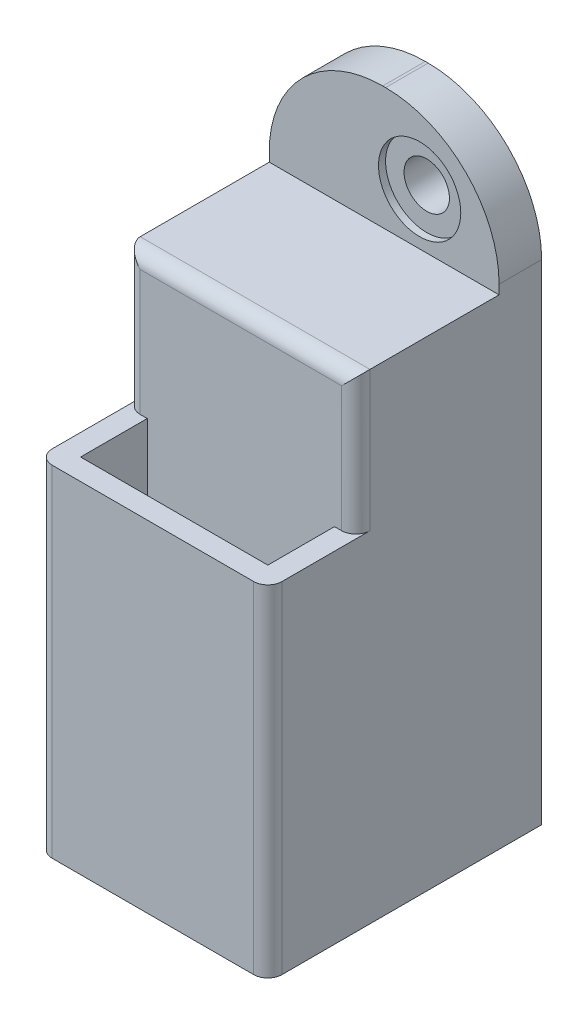
from build123d import *

# Parameters (mm, degrees)
CROQUIS2_W               = 16.2
CROQUIS2_H               = 9.2
CROQUIS2_W_2             = 13.2
CROQUIS2_H_2             = 6.2
SALIENTE_EXTRUIR1_DEPTH  = 6.5
CROQUIS3_W               = 16.2
CROQUIS3_H               = 12
SALIENTE_EXTRUIR2_DEPTH  = 2
SALIENTE_EXTRUIR3_DEPTH  = 8.1
CROQUIS5_W               = 16.2
CROQUIS5_H               = 3
SALIENTE_EXTRUIR4_DEPTH  = 13
CROQUIS6_R               = 1.6
CORTAR_EXTRUIR1_DEPTH    = 3
CROQUIS7_W               = 16.2
CROQUIS7_H               = 2
SALIENTE_EXTRUIR5_DEPTH  = 3
CROQUIS8_R               = 2.9
CORTAR_EXTRUIR2_DEPTH    = 0.5
REDONDEO1_R              = 1
REDONDEO6_R              = 8
CROQUIS9_W               = 13.2
CROQUIS9_H               = 6.2
SALIENTE_EXTRUIR6_DEPTH  = 3.5
CROQUIS10_W              = 13.2
CROQUIS10_H              = 1.5
SALIENTE_EXTRUIR7_DEPTH  = 3.5
CROQUIS11_W              = 13.2
CROQUIS11_H              = 6.2
SALIENTE_EXTRUIR8_DEPTH  = 14
CROQUIS12_W              = 13.2
CROQUIS12_H              = 1.5
SALIENTE_EXTRUIR9_DEPTH  = 14
CROQUIS13_W              = 16.2
CROQUIS13_H              = 7.85
SALIENTE_EXTRUIR10_DEPTH = 10.1
CROQUIS14_W              = 12.6
CROQUIS14_H              = 6.5
CORTAR_EXTRUIR3_DEPTH    = 8.1
REDONDEO7_R              = 1


with BuildPart() as part:
    # Croquis2 → Saliente-Extruir1 (new body)
    with BuildSketch(Plane(origin=(0, 0, 0), x_dir=(1, 0, 0), z_dir=(0, 1, 0))):
        with Locations((6.6, -3.1)):
            Rectangle(CROQUIS2_W, CROQUIS2_H)
        with Locations((6.6, -3.1)):
            Rectangle(CROQUIS2_W_2, CROQUIS2_H_2, mode=Mode.SUBTRACT)
    extrude(amount=SALIENTE_EXTRUIR1_DEPTH)

    # Croquis3 → Saliente-Extruir2 (add)
    with BuildSketch(Plane(origin=(0, 0, -1.5), x_dir=(-1, 0, 0), z_dir=(0, 0, -1))):
        with Locations((-6.6, 6)):
            Rectangle(CROQUIS3_W, CROQUIS3_H)
    extrude(amount=SALIENTE_EXTRUIR2_DEPTH)

    # Croquis4 → Saliente-Extruir3 (add)
    with BuildSketch(Plane(origin=(0, 0, -3.5), x_dir=(-1, 0, 0), z_dir=(0, 0, -1))):
        Polygon((1.5, 0), (1.5, 12), (-14.7, 12), (-14.7, 0), (-12.9, 0), (-12.9, 11), (-0.3, 11), (-0.3, 0), align=None)
    extrude(amount=SALIENTE_EXTRUIR3_DEPTH)

    # Croquis5 → Saliente-Extruir4 (add)
    with BuildSketch(Plane(origin=(0, 12, 0), x_dir=(1, 0, 0), z_dir=(0, 1, 0))):
        with Locations((6.6, 10.1)):
            Rectangle(CROQUIS5_W, CROQUIS5_H)
    extrude(amount=SALIENTE_EXTRUIR4_DEPTH)

    # Croquis6 → Cortar-Extruir1 (cut)
    with BuildSketch(Plane.XY.offset(-8.6)):
        with Locations((9.1, 20)):
            Circle(CROQUIS6_R)
    extrude(amount=-CORTAR_EXTRUIR1_DEPTH, mode=Mode.SUBTRACT)

    # Croquis7 → Saliente-Extruir5 (add)
    with BuildSketch(Plane.XY.offset(-1.5)):
        with Locations((6.6, 7.5)):
            Rectangle(CROQUIS7_W, CROQUIS7_H)
    extrude(amount=SALIENTE_EXTRUIR5_DEPTH)

    # Croquis8 → Cortar-Extruir2 (cut)
    with BuildSketch(Plane.XY.offset(-8.6)):
        with Locations((9.1, 20)):
            Circle(CROQUIS8_R)
    extrude(amount=-CORTAR_EXTRUIR2_DEPTH, mode=Mode.SUBTRACT)

    # Redondeo1
    redondeo1_edges = [part.edges().sort_by_distance(p)[0] for p in [
        (14.7, 3.25, 7.7),
        (-1.5, 3.25, 7.7),
    ]]
    fillet(redondeo1_edges, radius=REDONDEO1_R)

    # Redondeo6
    redondeo6_edges = [part.edges().sort_by_distance(p)[0] for p in [
        (14.7, 25, -10.1),
        (-1.5, 25, -10.1),
    ]]
    fillet(redondeo6_edges, radius=REDONDEO6_R)

    # Croquis9 → Saliente-Extruir6 (add)
    with BuildSketch(Plane.XZ):
        with BuildLine():
            Line((13.7, 7.7), (-0.5, 7.7))
            ThreePointArc((-0.5, 7.7), (-1.207106781, 7.407106781), (-1.5, 6.7))
            Line((-1.5, 6.7), (-1.5, -11.6))
            Line((-1.5, -11.6), (0.3, -11.6))
            Line((0.3, -11.6), (0.3, -3.5))
            Line((0.3, -3.5), (12.9, -3.5))
            Line((12.9, -3.5), (12.9, -11.6))
            Line((12.9, -11.6), (14.7, -11.6))
            Line((14.7, -11.6), (14.7, 6.7))
            ThreePointArc((14.7, 6.7), (14.407106781, 7.407106781), (13.7, 7.7))
        make_face()
        with Locations((6.6, 3.1)):
            Rectangle(CROQUIS9_W, CROQUIS9_H, mode=Mode.SUBTRACT)
    extrude(amount=SALIENTE_EXTRUIR6_DEPTH)

    # Croquis10 → Saliente-Extruir7 (add)
    with BuildSketch(Plane.XZ.offset(-6.5)):
        with Locations((6.6, 0.75)):
            Rectangle(CROQUIS10_W, CROQUIS10_H)
    extrude(amount=SALIENTE_EXTRUIR7_DEPTH)

    # Croquis11 → Saliente-Extruir8 (add)
    with BuildSketch(Plane.XZ.offset(3.5)):
        with BuildLine():
            Line((13.7, 7.7), (-0.5, 7.7))
            ThreePointArc((-0.5, 7.7), (-1.207106781, 7.407106781), (-1.5, 6.7))
            Line((-1.5, 6.7), (-1.5, -11.6))
            Line((-1.5, -11.6), (0.3, -11.6))
            Line((0.3, -11.6), (0.3, -3.5))
            Line((0.3, -3.5), (12.9, -3.5))
            Line((12.9, -3.5), (12.9, -11.6))
            Line((12.9, -11.6), (14.7, -11.6))
            Line((14.7, -11.6), (14.7, 6.7))
            ThreePointArc((14.7, 6.7), (14.407106781, 7.407106781), (13.7, 7.7))
        make_face()
        with Locations((6.6, 3.1)):
            Rectangle(CROQUIS11_W, CROQUIS11_H, mode=Mode.SUBTRACT)
    extrude(amount=SALIENTE_EXTRUIR8_DEPTH)

    # Croquis12 → Saliente-Extruir9 (add)
    with BuildSketch(Plane.XZ.offset(-3)):
        with Locations((6.6, 0.75)):
            Rectangle(CROQUIS12_W, CROQUIS12_H)
    extrude(amount=SALIENTE_EXTRUIR9_DEPTH)

    # Croquis13 → Saliente-Extruir10 (add)
    with BuildSketch(Plane.XY.offset(-8.6)):
        with Locations((6.6, 12.425)):
            Rectangle(CROQUIS13_W, CROQUIS13_H)
    extrude(amount=SALIENTE_EXTRUIR10_DEPTH)

    # Croquis14 → Cortar-Extruir3 (cut)
    with BuildSketch(Plane(origin=(0, 0, -11.6), x_dir=(-1, 0, 0), z_dir=(0, 0, -1))):
        with Locations((-6.6, 11.75)):
            Rectangle(CROQUIS14_W, CROQUIS14_H)
    extrude(amount=-CORTAR_EXTRUIR3_DEPTH, mode=Mode.SUBTRACT)

    # Redondeo7
    redondeo7_edges = [part.edges().sort_by_distance(p)[0] for p in [
        (6.6, 16.35, 1.5),
        (14.7, 11.425, 1.5),
        (-1.5, 11.425, 1.5),
    ]]
    fillet(redondeo7_edges, radius=REDONDEO7_R)


solid = part.part
